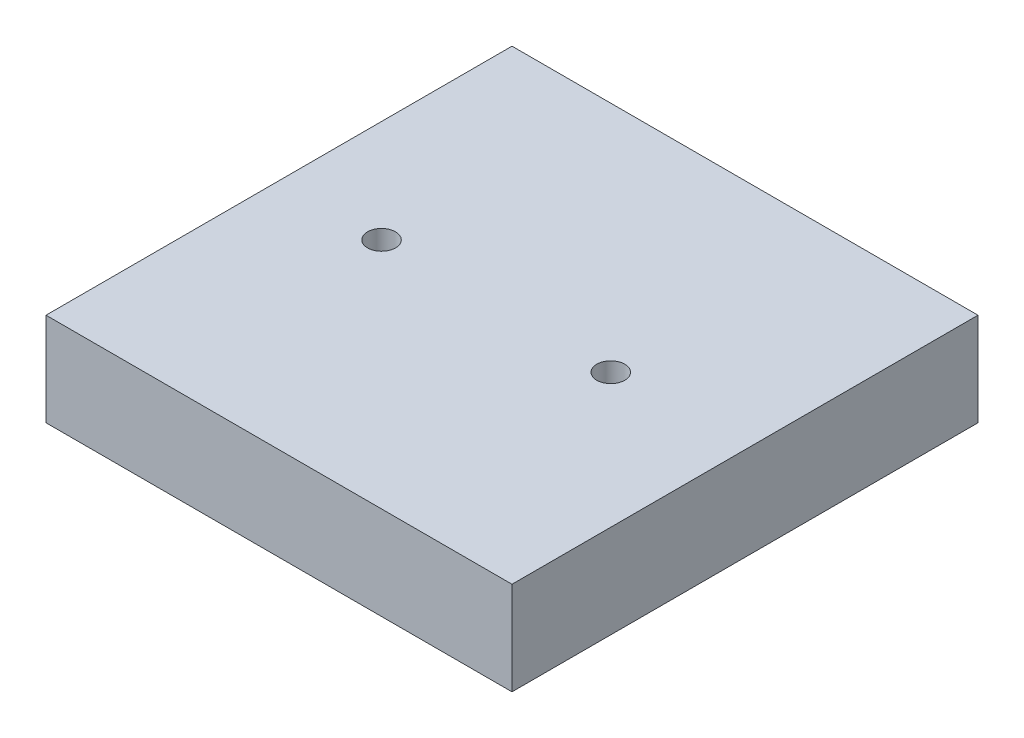
from build123d import *

# Parameters (mm, degrees)
EXTRUDE_1_DEPTH = 10


with BuildPart() as part:
    # ｽｹｯﾁ1 → ﾎﾞｽ - 押し出し1 (new body)
    with BuildSketch(Plane(origin=(0, 0, 0), x_dir=(1, 0, 0), z_dir=(0, 1, 0))):
        with BuildLine():
            ThreePointArc((9.1, 0), (10.6, 1.5), (12.1, 0))
            Line((12.1, 0), (25, 0))
            Line((25, 0), (25, 25))
            Line((25, 25), (-25, 25))
            Line((-25, 25), (-25, 0))
            Line((-25, 0), (-15.5, 0))
            ThreePointArc((-15.5, 0), (-14, 1.5), (-12.5, 0))
            Line((-12.5, 0), (0, 0))
            Line((0, 0), (9.1, 0))
        make_face()
        with BuildLine():
            Line((25, 0), (12.1, 0))
            ThreePointArc((12.1, 0), (10.6, -1.5), (9.1, 0))
            Line((9.1, 0), (0, 0))
            Line((0, 0), (-12.5, 0))
            ThreePointArc((-12.5, 0), (-14, -1.5), (-15.5, 0))
            Line((-15.5, 0), (-25, 0))
            Line((-25, 0), (-25, -25))
            Line((-25, -25), (25, -25))
            Line((25, -25), (25, 0))
        make_face()
    extrude(amount=EXTRUDE_1_DEPTH)


solid = part.part
